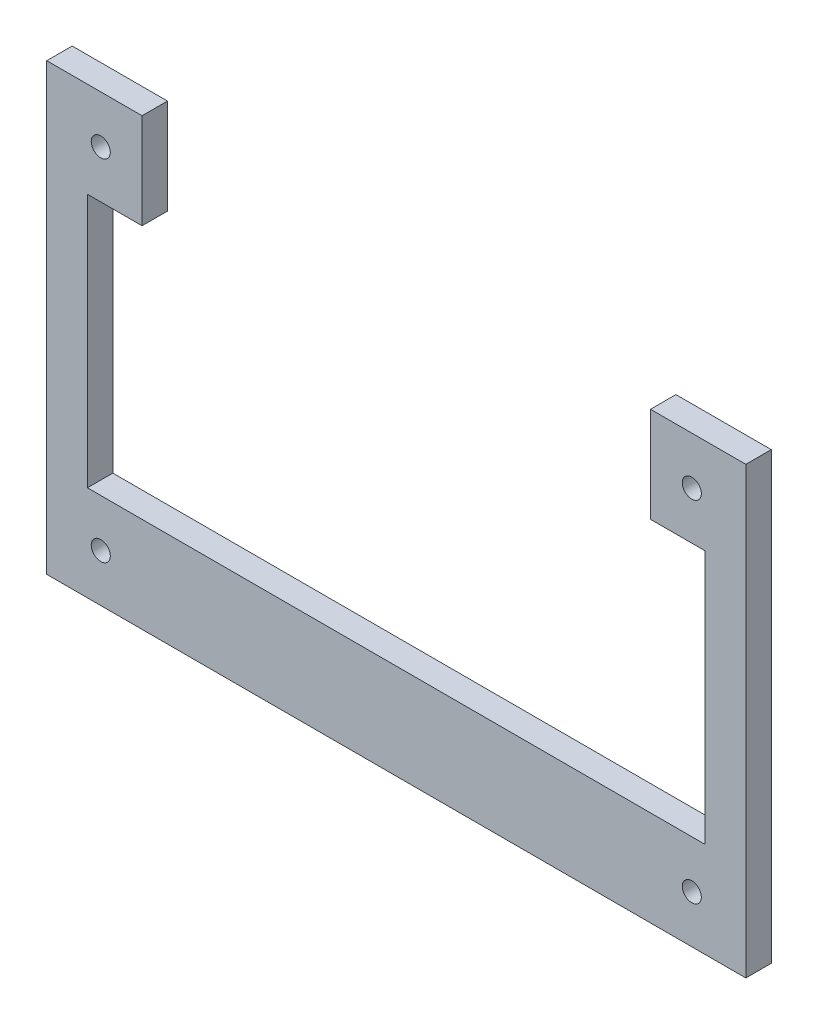
from build123d import *

# Parameters (mm, degrees)
SKETCH1_W             = 110
SKETCH1_H             = 70
PLATE_DEPTH           = 4
SKETCH2_W             = 97.2
SKETCH2_H             = 40
SCREEN_HOLE_DEPTH     = 66.314623171
F_3_0MM_DOWEL_HOLE1_D = 3
SKETCH6_W             = 80
SKETCH6_H             = 15
CUT_EXTRUDE1_DEPTH    = 66.314623171


with BuildPart() as part:
    # Sketch1 → Plate (new body)
    with BuildSketch(Plane.XY):
        Rectangle(SKETCH1_W, SKETCH1_H)
    extrude(amount=PLATE_DEPTH)

    # Sketch2 → Screen hole (cut, through all)
    with BuildSketch(Plane(origin=(0, 0, 0), x_dir=(-1, 0, 0), z_dir=(0, 0, -1))):
        Rectangle(SKETCH2_W, SKETCH2_H)
    extrude(amount=-SCREEN_HOLE_DEPTH, mode=Mode.SUBTRACT)

    # Ø3.0mm Dowel Hole1 (through all)
    with Locations(Plane(origin=(46.5, 27.5, 0), x_dir=(-1, 0, 0), z_dir=(0, 0, -1))):
        with Locations((0, 0), (93, 0), (93, -55), (0, -55)):
            Hole(F_3_0MM_DOWEL_HOLE1_D / 2)

    # Sketch6 → Cut-Extrude1 (cut, through all)
    with BuildSketch(Plane(origin=(0, 0, 0), x_dir=(-1, 0, 0), z_dir=(0, 0, -1))):
        with Locations((0, 27.5)):
            Rectangle(SKETCH6_W, SKETCH6_H)
    extrude(amount=-CUT_EXTRUDE1_DEPTH, mode=Mode.SUBTRACT)


solid = part.part
